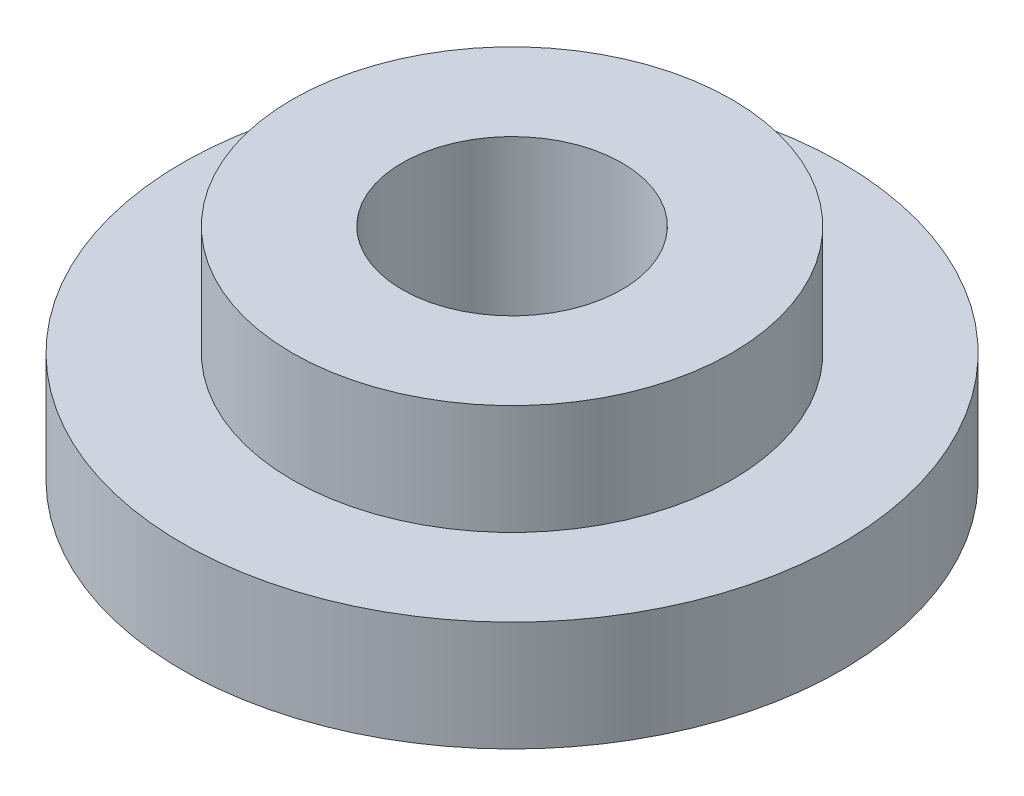
from build123d import *


with BuildPart() as part:
    # Croquis1 → Revolución1 (revolve)
    with BuildSketch(Plane.XY, mode=Mode.PRIVATE) as revoluci_n1_sk:
        Polygon((-2, 4), (-2, 0), (-6, 0), (-6, 2), (-4, 2), (-4, 4), align=None)
    revolve(revoluci_n1_sk.sketch.rotate(Axis((0, 0, 0), (0, 1, 0)), 270), axis=Axis((0, 0, 0), (0, 1, 0)))


solid = part.part
